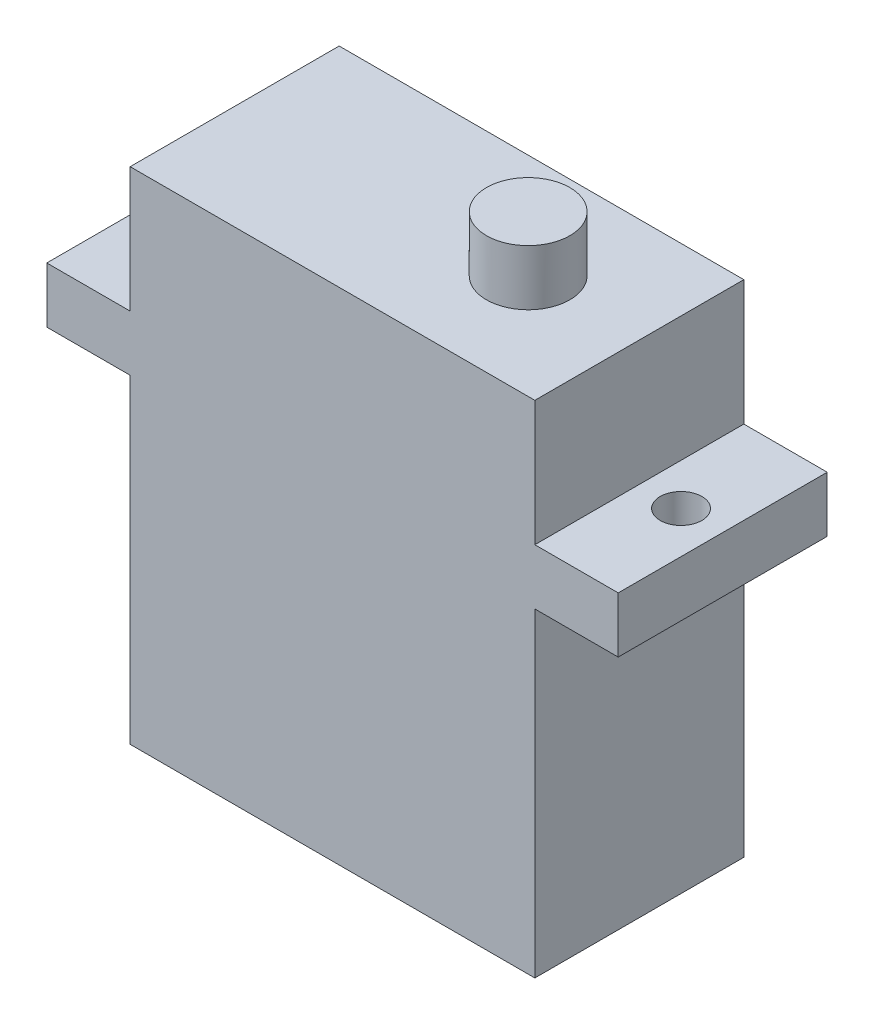
from build123d import *

# Parameters (mm, degrees)
SKETCH2_W           = 23.114
SKETCH2_H           = 11.938
BOSS_EXTRUDE1_DEPTH = 28.575
SKETCH3_W           = 4.7625
SKETCH3_H           = 3.175
BOSS_EXTRUDE2_DEPTH = 11.938
SKETCH5_R           = 2.38125
BOSS_EXTRUDE3_DEPTH = 3.175
SKETCH8_R           = 1.190625
CUT_EXTRUDE1_DEPTH  = 28.590823072


with BuildPart() as part:
    # Sketch2 → Boss-Extrude1 (new body)
    with BuildSketch(Plane(origin=(0, 0, 0), x_dir=(1, 0, 0), z_dir=(0, 1, 0))):
        Rectangle(SKETCH2_W, SKETCH2_H)
    extrude(amount=BOSS_EXTRUDE1_DEPTH)

    # Sketch3 → Boss-Extrude2 (add, through all)
    with BuildSketch(Plane.XY.offset(5.969)):
        with Locations((13.93825, 19.84375)):
            Rectangle(SKETCH3_W, SKETCH3_H)
    boss_extrude2 = extrude(amount=-BOSS_EXTRUDE2_DEPTH)

    # Mirror1: Boss-Extrude2 across plane
    add(boss_extrude2.mirror(Plane(origin=(0, 0, 0), x_dir=(0, 0, 1), z_dir=(1, 0, 0))))

    # Sketch5 → Boss-Extrude3 (add)
    with BuildSketch(Plane(origin=(0, 28.575, 0), x_dir=(1, 0, 0), z_dir=(0, 1, 0))):
        with Locations(Location((5.207, 0, 0), (0, 0, 90))):
            Circle(SKETCH5_R)
    extrude(amount=BOSS_EXTRUDE3_DEPTH)

    # Sketch8 → Cut-Extrude1 (cut, through all)
    with BuildSketch(Plane(origin=(0, 21.43125, 0), x_dir=(1, 0, 0), z_dir=(0, 1, 0))):
        with Locations(Location((13.93825, 0, 0), (0, 0, 270))):
            Circle(SKETCH8_R)
    cut_extrude1 = extrude(amount=-CUT_EXTRUDE1_DEPTH, mode=Mode.SUBTRACT)

    # Mirror2: Cut-Extrude1 across plane
    add(cut_extrude1.mirror(Plane(origin=(0, 0, 0), x_dir=(0, 0, 1), z_dir=(1, 0, 0))), mode=Mode.SUBTRACT)


solid = part.part
